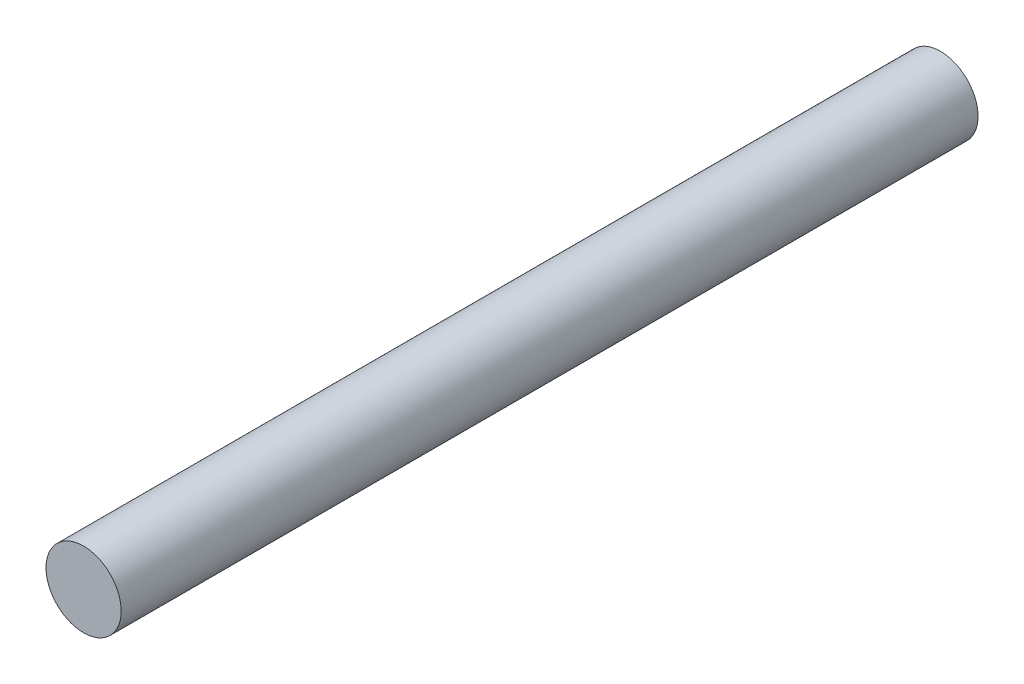
from build123d import *

# Parameters (mm, degrees)
SKETCH_1_R      = 2.5
EXTRUDE_1_DEPTH = 57


with BuildPart() as part:
    # Эскиз1 → Вытянуть1 (new body)
    with BuildSketch(Plane.XY):
        with Locations(Location((0, 0, 0), (0, 0, 180))):
            Circle(SKETCH_1_R)
    extrude(amount=EXTRUDE_1_DEPTH)


solid = part.part
